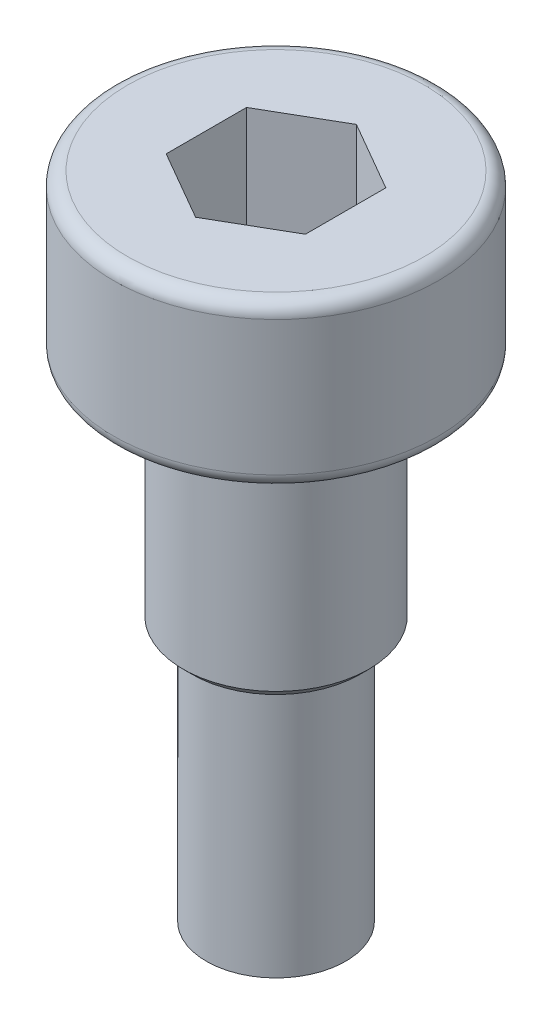
from build123d import *

# Parameters (mm, degrees)
FILLET_1_R          = 0.3
CUT_EXTRUDE_1_DEPTH = 2.4
CHAMFER_1_SIZE      = 0.2


with BuildPart() as part:
    # 草图1 → 旋转1 (revolve)
    with BuildSketch(Plane.XY):
        Polygon((0, 3.5), (-3.5, 3.5), (-3.5, 0), (-2, 0), (-2, -5), (-1.5, -5), (-1.5, -10.5), (0, -10.5), align=None)
    revolve(axis=Axis((0, 3.5, 0), (0, -1, 0)))

    # 圆角1
    fillet_1_edges = [part.edges().sort_by_distance(p)[0] for p in [
        (3.5, 0, 0),
        (3.5, 3.5, 0),
    ]]
    fillet(fillet_1_edges, radius=FILLET_1_R)

    # 草图2 → 切除-拉伸1 (cut)
    with BuildSketch(Plane(origin=(0, 3.5, 0), x_dir=(1, 0, 0), z_dir=(0, 1, 0))):
        Polygon((1.5, -0.866025404), (1.5, 0.866025404), (0, 1.732050808), (-1.5, 0.866025404), (-1.5, -0.866025404), (0, -1.732050808), align=None)
    extrude(amount=-CUT_EXTRUDE_1_DEPTH, mode=Mode.SUBTRACT)

    # 倒角1
    chamfer_1_edges = [part.edges().sort_by_distance(p)[0] for p in [
        (2, -5, 0),
    ]]
    chamfer(chamfer_1_edges, length=CHAMFER_1_SIZE)


solid = part.part
